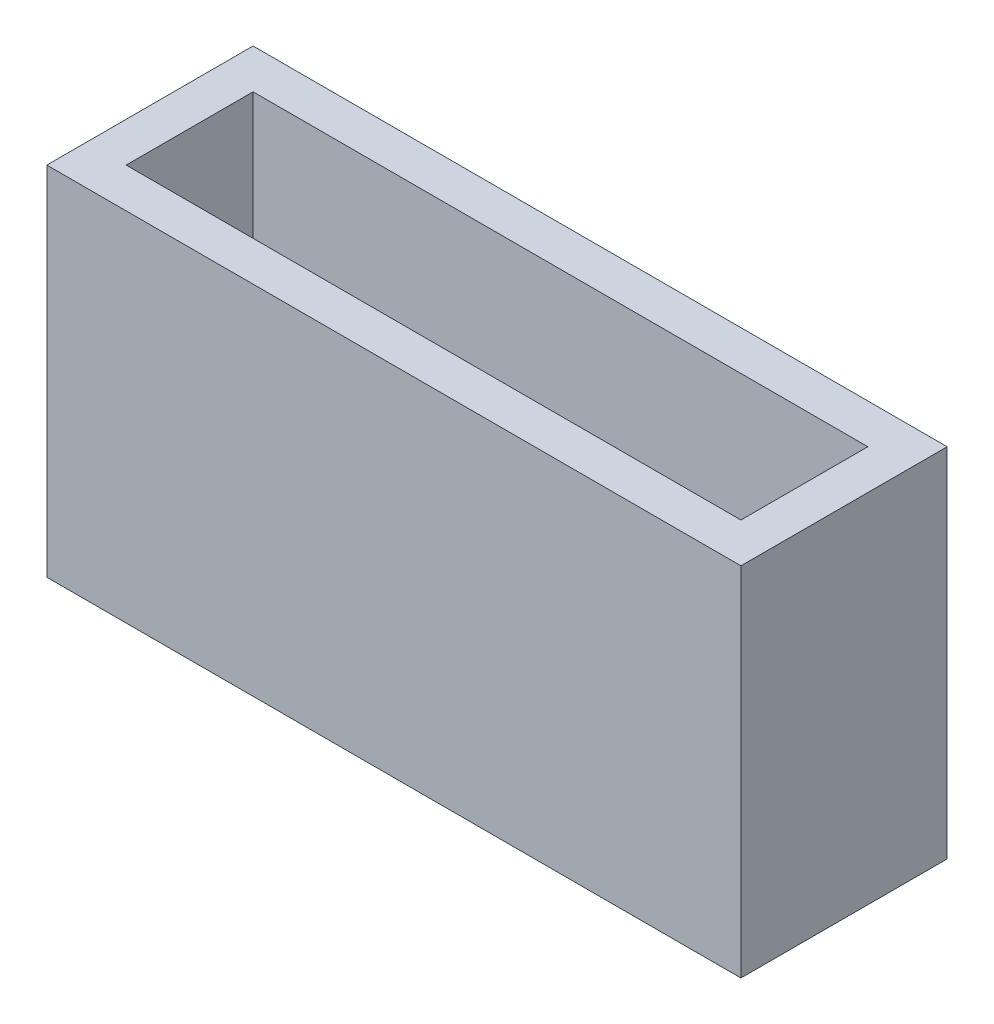
from build123d import *

# Parameters (mm, degrees)
SKETCH1_W           = 17.5
SKETCH1_H           = 5.2
SKETCH1_W_2         = 15.5
SKETCH1_H_2         = 3.2
BOSS_EXTRUDE1_DEPTH = 7.5
SKETCH2_W           = 17.5
SKETCH2_H           = 5.2
BOSS_EXTRUDE2_DEPTH = 1.5


with BuildPart() as part:
    # Sketch1 → Boss-Extrude1 (new body)
    with BuildSketch(Plane(origin=(0, 0, 0), x_dir=(1, 0, 0), z_dir=(0, 1, 0))):
        with Locations((7.75, 1.6)):
            Rectangle(SKETCH1_W, SKETCH1_H)
        with Locations((7.75, 1.6)):
            Rectangle(SKETCH1_W_2, SKETCH1_H_2, mode=Mode.SUBTRACT)
    extrude(amount=BOSS_EXTRUDE1_DEPTH)

    # Sketch2 → Boss-Extrude2 (add)
    with BuildSketch(Plane.XZ):
        with Locations((7.75, -1.6)):
            Rectangle(SKETCH2_W, SKETCH2_H)
    extrude(amount=BOSS_EXTRUDE2_DEPTH)


solid = part.part
